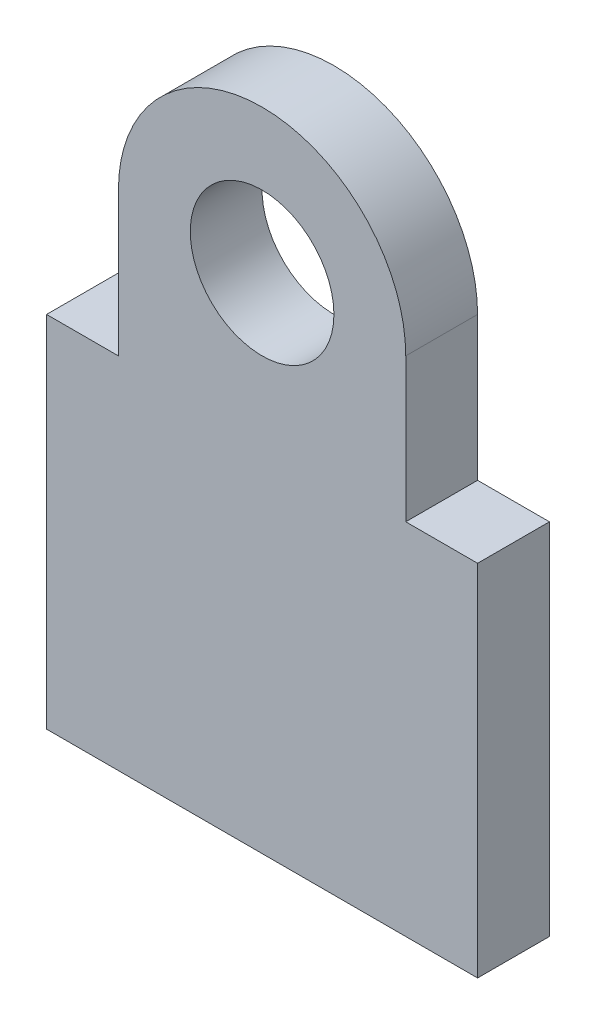
from build123d import *

# Parameters (mm, degrees)
BOSS_EXTRUDE1_DEPTH = 10
SKETCH2_R           = 10
BOSS_EXTRUDE2_DEPTH = 20
SKETCH3_W           = 60
SKETCH3_H           = 30
BOSS_EXTRUDE3_DEPTH = 10
CUT_EXTRUDE1_START  = -30
SKETCH4_R           = 10
CUT_EXTRUDE1_DEPTH  = 30


with BuildPart() as part:
    # Sketch1 → Boss-Extrude1 (new body)
    with BuildSketch(Plane.XY):
        with BuildLine():
            Line((-30, 0), (30, 0))
            Line((30, 0), (30, 20))
            Line((30, 20), (20, 20))
            Line((20, 20), (20, 40))
            ThreePointArc((20, 40), (0, 60), (-20, 40))
            Line((-20, 40), (-20, 20))
            Line((-20, 20), (-30, 20))
            Line((-30, 20), (-30, 0))
        make_face()
    extrude(amount=BOSS_EXTRUDE1_DEPTH)

    # Sketch2 → Boss-Extrude2 (add)
    with BuildSketch(Plane.XY.offset(10)):
        with Locations((0, 40)):
            Circle(SKETCH2_R)
    extrude(amount=BOSS_EXTRUDE2_DEPTH)

    # Sketch3 → Boss-Extrude3 (add)
    with BuildSketch(Plane.XY.offset(10)):
        with Locations((0, -15)):
            Rectangle(SKETCH3_W, SKETCH3_H)
    extrude(amount=-BOSS_EXTRUDE3_DEPTH)

    # Sketch4 → Cut-Extrude1 (cut)
    with BuildSketch(Plane.XY.offset(30).offset(CUT_EXTRUDE1_START)):
        with Locations((0, 40)):
            Circle(SKETCH4_R)
    extrude(amount=CUT_EXTRUDE1_DEPTH, mode=Mode.SUBTRACT)


solid = part.part
